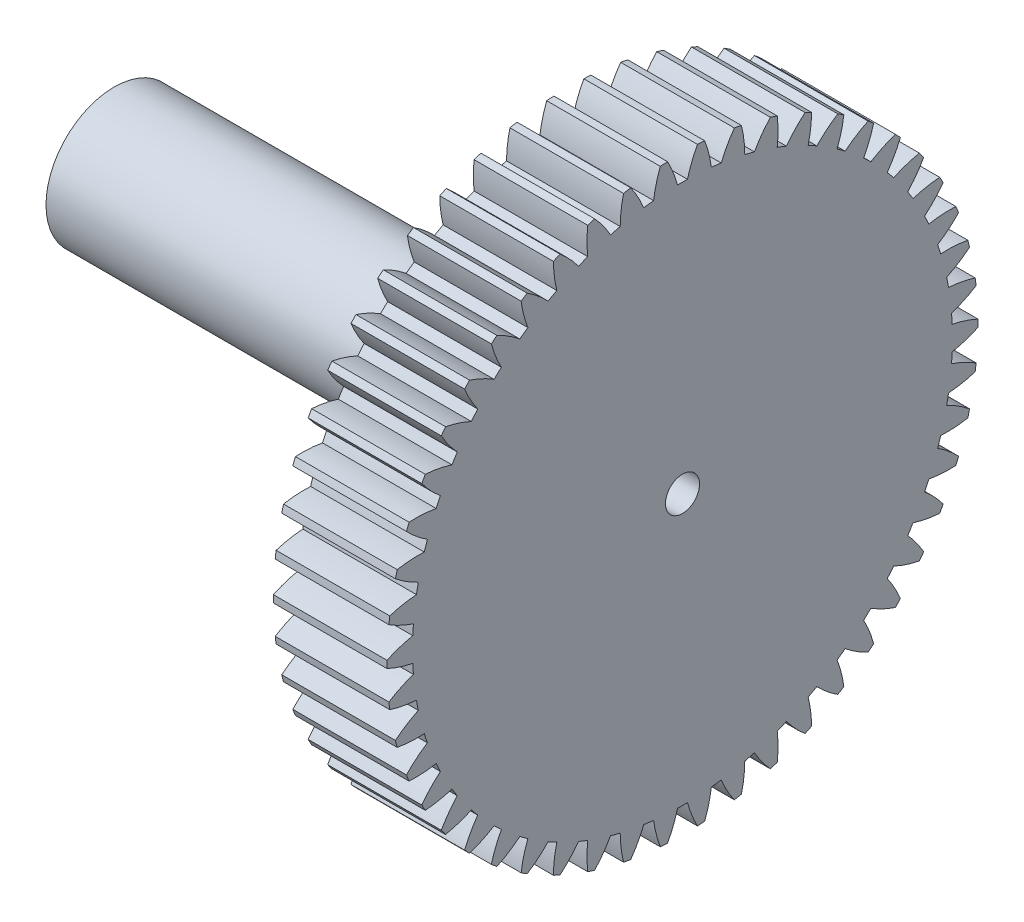
from build123d import *

# Parameters (mm, degrees)
BASPROSKE_W      = 10
BASPROSKE_H      = 26
TOOTHCUT_DEPTH   = 39.105117767
TEETHCUTS_COUNT  = 50
TEETHCUTS_ANGLE  = 352.8
HUBNEAONESKE_R   = 6
HUBNEARONE_DEPTH = 40.0000508
BORSKE_R         = 1.5
BORE_DEPTH       = 50.0000508


with BuildPart() as part:
    # BasProSke → Base-Revolve (revolve)
    with BuildSketch(Plane(origin=(0, 0, 0), x_dir=(1, 0, 0), z_dir=(0, 1, 0)), mode=Mode.PRIVATE) as base_revolve_sk:
        with Locations((5, 13)):
            Rectangle(BASPROSKE_W, BASPROSKE_H)
    revolve(base_revolve_sk.sketch.rotate(Axis((-10, 0, 0), (1, 0, 0)), 180), axis=Axis((-10, 0, 0), (1, 0, 0)))

    # TooCutSke → ToothCut (cut, through all)
    with BuildSketch(Plane(origin=(0, 0, 0), x_dir=(0, 0, -1), z_dir=(1, 0, 0))):
        with BuildLine():
            ThreePointArc((0.437663408, 23.744966872), (0, 23.749), (-0.437663408, 23.744966872))
            ThreePointArc((-0.437663408, 23.744966872), (-0.815428123, 24.895236298), (-1.329433358, 25.991422664))
            ThreePointArc((-1.329433358, 25.991422664), (0, 26.0254), (1.329433358, 25.991422664))
            ThreePointArc((1.329433358, 25.991422664), (0.815428123, 24.895236298), (0.437663408, 23.744966872))
        make_face()
    toothcut = extrude(amount=TOOTHCUT_DEPTH, mode=Mode.SUBTRACT)

    # TeethCuts: ToothCut ×50 about axis
    teethcuts_axis = Axis((-10, 0, 0), (1, 0, 0))
    for i in range(1, TEETHCUTS_COUNT):
        add(toothcut.rotate(teethcuts_axis, i * TEETHCUTS_ANGLE / (TEETHCUTS_COUNT - 1)), mode=Mode.SUBTRACT)

    # HubNeaOneSke → HubNearOne (add)
    with BuildSketch(Plane.ZY):
        with Locations(Location((0, 0, 0), (0, 0, 180))):
            Circle(HUBNEAONESKE_R)
    extrude(amount=HUBNEARONE_DEPTH)

    # BorSke → Bore (cut, symmetric)
    with BuildSketch(Plane(origin=(0, 0, 0), x_dir=(0, 0, -1), z_dir=(1, 0, 0))):
        with Locations(Location((0, 0, 0), (0, 0, 180))):
            Circle(BORSKE_R)
    extrude(amount=BORE_DEPTH, both=True, mode=Mode.SUBTRACT)


solid = part.part
